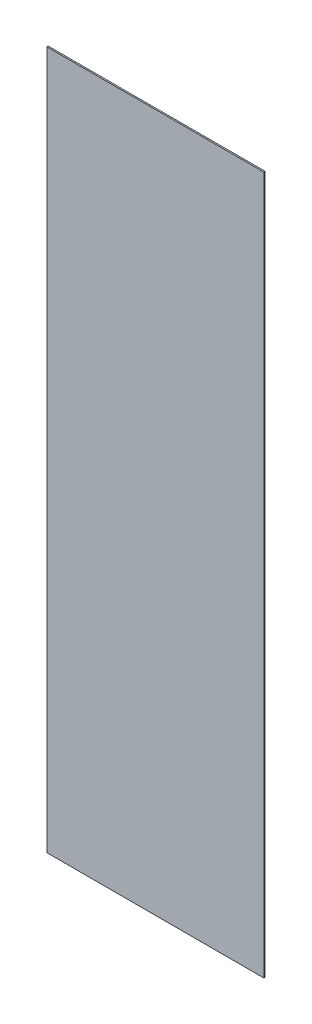
from build123d import *

# Parameters (mm, degrees)
CROQUIS1_W              = 3160
CROQUIS1_H              = 10160
SALIENTE_EXTRUIR1_DEPTH = 20


with BuildPart() as part:
    # Croquis1 → Saliente-Extruir1 (new body)
    with BuildSketch(Plane.XY):
        Rectangle(CROQUIS1_W, CROQUIS1_H)
    extrude(amount=SALIENTE_EXTRUIR1_DEPTH)


solid = part.part
